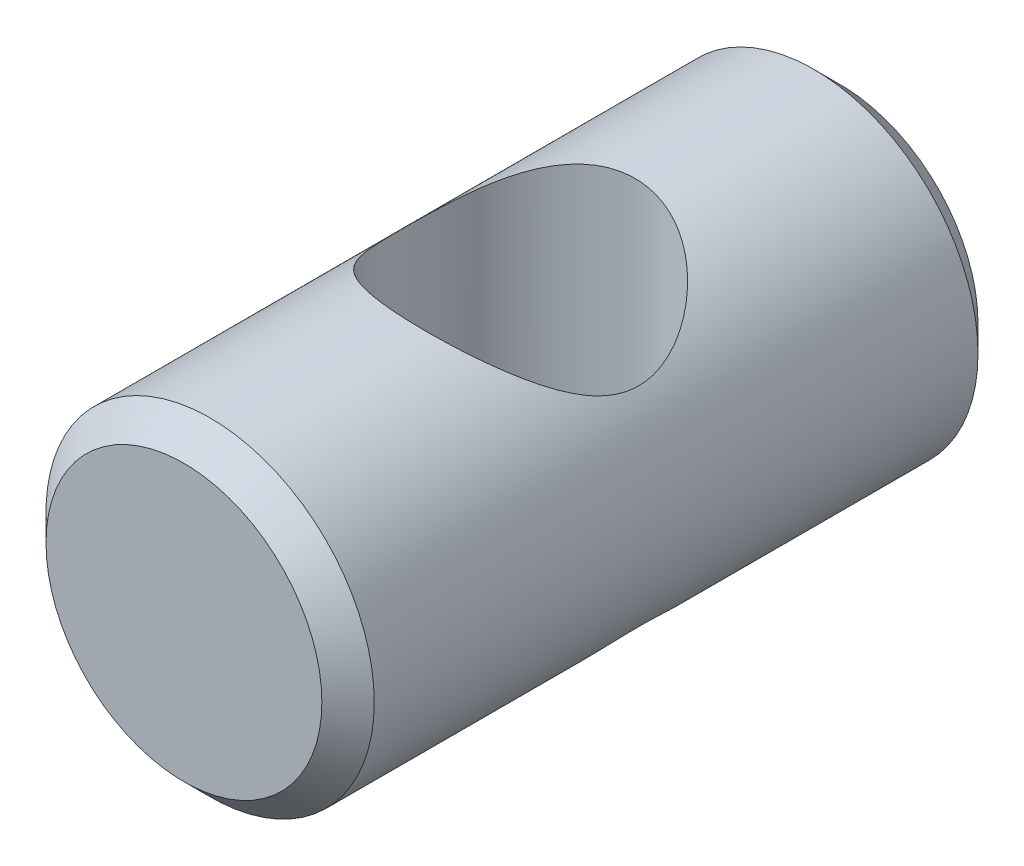
from build123d import *

# Parameters (mm, degrees)
SKETCH1_R               = 4.765
BOSS_EXTRUDE1_DEPTH     = 9.525
CHAMFER1_SIZE           = 0.76
CUT_EXTRUDE1_DEPTH      = 12.667736499
CUT_EXTRUDE1_DEPTH_BACK = 12.667736499
SKETCH2_R               = 3.43


with BuildPart() as part:
    # Sketch1 → Boss-Extrude1 (new, symmetric)
    with BuildSketch(Plane.XY):
        with Locations(Location((0, 0, 0), (0, 0, 180))):
            Circle(SKETCH1_R)
    extrude(amount=BOSS_EXTRUDE1_DEPTH, both=True)

    # Chamfer1
    chamfer1_edges = [part.edges().sort_by_distance(p)[0] for p in [
        (4.765, 0, -9.525),
        (4.765, 0, 9.525),
    ]]
    chamfer(chamfer1_edges, length=CHAMFER1_SIZE)

    # Sketch2 → Cut-Extrude1 (cut, two sides: drawn at the far end of the back side and taken through both)
    with BuildSketch(Plane(origin=(0, 0, 0), x_dir=(1, 0, 0), z_dir=(0, 1, 0)).offset(-CUT_EXTRUDE1_DEPTH_BACK)):
        with Locations(Location((0.25, 0, 0), (0, 0, 270))):
            Circle(SKETCH2_R)
    extrude(amount=CUT_EXTRUDE1_DEPTH + CUT_EXTRUDE1_DEPTH_BACK, mode=Mode.SUBTRACT)


solid = part.part
